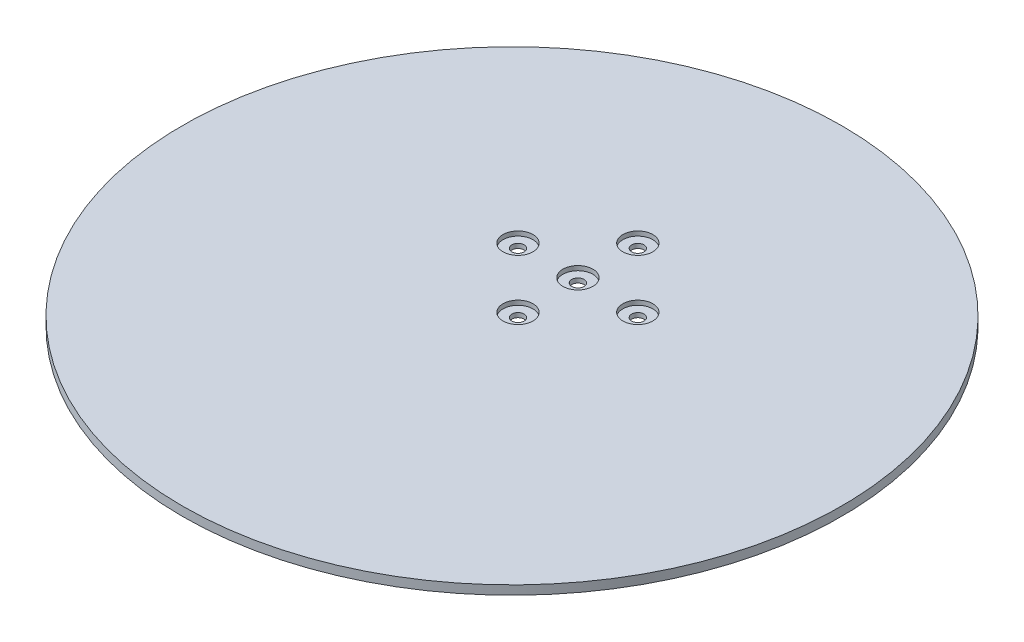
from build123d import *

# Parameters (mm, degrees)
SKETCH_1_R               = 110
EXTRUDE_1_DEPTH          = 3
CUT_EXTRUDE_1_DEPTH      = 156.592416268
CUT_EXTRUDE_1_DEPTH_BACK = 156.592416268
SKETCH_2_R               = 2.05
SKETCH_4_R               = 5
CUT_EXTRUDE_2_DEPTH      = 1.5


with BuildPart() as part:
    # 草图1 → 凸台-拉伸1 (new body)
    with BuildSketch(Plane(origin=(0, 0, 0), x_dir=(1, 0, 0), z_dir=(0, 1, 0))):
        with Locations(Location((0, 0, 0), (0, 0, 270))):
            Circle(SKETCH_1_R)
    extrude(amount=EXTRUDE_1_DEPTH)

    # 草图2 → 切除-拉伸1 (cut, two sides: drawn at the far end of the back side and taken through both)
    with BuildSketch(Plane(origin=(0, 3, 0), x_dir=(1, 0, 0), z_dir=(0, 1, 0)).offset(-CUT_EXTRUDE_1_DEPTH_BACK)):
        with Locations(Location((20, 22, 0), (0, 0, 270))):
            Circle(SKETCH_2_R)
        with Locations(Location((0, 22, 0), (0, 0, 270))):
            Circle(SKETCH_2_R)
        with Locations(Location((0, 42, 0), (0, 0, 270))):
            Circle(SKETCH_2_R)
        with Locations(Location((0, 2, 0), (0, 0, 270))):
            Circle(SKETCH_2_R)
        with Locations(Location((-20, 22, 0), (0, 0, 270))):
            Circle(SKETCH_2_R)
    extrude(amount=CUT_EXTRUDE_1_DEPTH + CUT_EXTRUDE_1_DEPTH_BACK, mode=Mode.SUBTRACT)

    # 草图4 → 切除-拉伸2 (cut)
    with BuildSketch(Plane(origin=(0, 3, 0), x_dir=(1, 0, 0), z_dir=(0, 1, 0))):
        with Locations(Location((0, 22, 0), (0, 0, 270))):
            Circle(SKETCH_4_R)
        with Locations(Location((20, 22, 0), (0, 0, 270))):
            Circle(SKETCH_4_R)
        with Locations(Location((0, 42, 0), (0, 0, 270))):
            Circle(SKETCH_4_R)
        with Locations(Location((0, 2, 0), (0, 0, 270))):
            Circle(SKETCH_4_R)
        with Locations(Location((-20, 22, 0), (0, 0, 270))):
            Circle(SKETCH_4_R)
    extrude(amount=-CUT_EXTRUDE_2_DEPTH, mode=Mode.SUBTRACT)


solid = part.part
